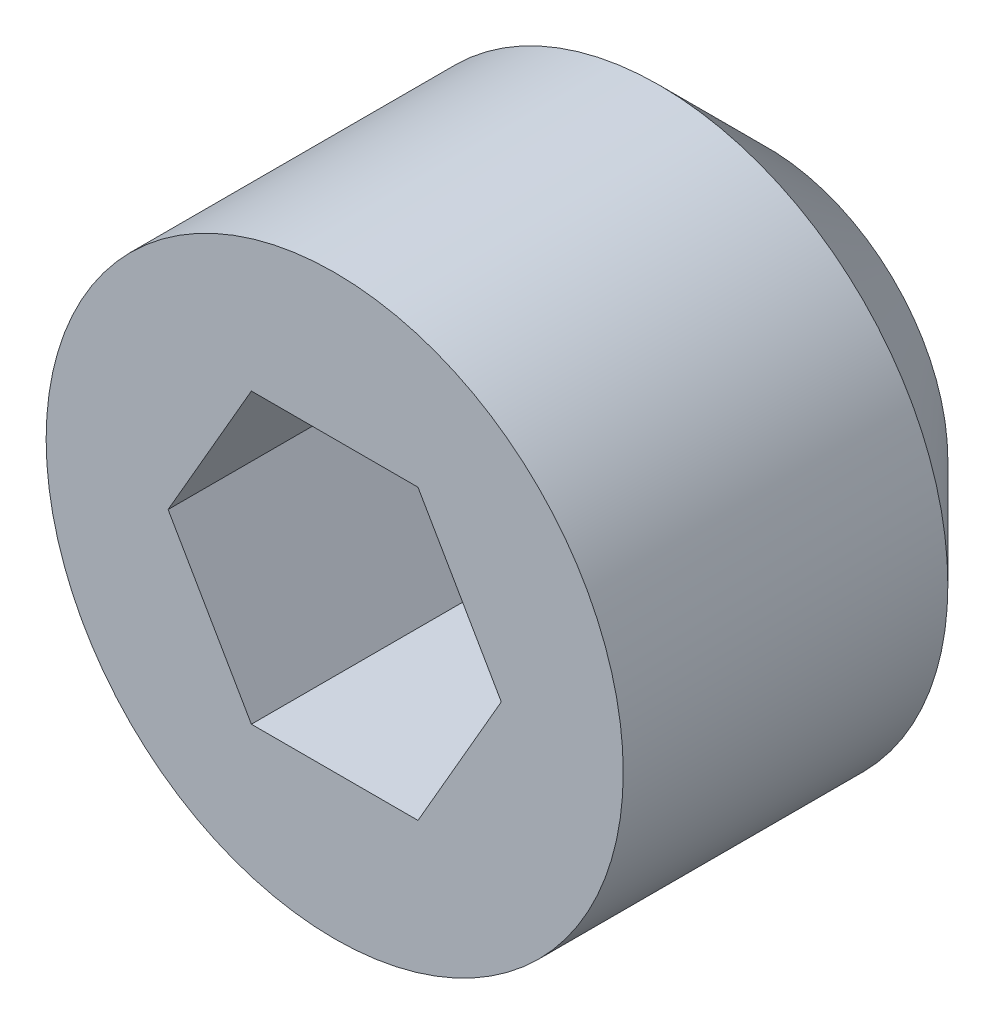
from build123d import *

# Parameters (mm, degrees)
SKETCH1_R           = 2
BOSS_EXTRUDE1_DEPTH = 3
CUT_EXTRUDE1_DEPTH  = 1.5


with BuildPart() as part:
    # Sketch1 → Boss-Extrude1 (new body)
    with BuildSketch(Plane.XY):
        Circle(SKETCH1_R)
    extrude(amount=-BOSS_EXTRUDE1_DEPTH)

    # Sketch2 → Cut-Extrude1 (cut)
    with BuildSketch(Plane.XY):
        Polygon((1.154700538, 0), (0.577350269, 1), (-0.577350269, 1), (-1.154700538, 0), (-0.577350269, -1), (0.577350269, -1), align=None)
    extrude(amount=-CUT_EXTRUDE1_DEPTH, mode=Mode.SUBTRACT)

    # Sketch3 → Chamfer 2 (revolve, cut)
    with BuildSketch(Plane(origin=(0, 0, 0), x_dir=(0, 0, -1), z_dir=(1, 0, 0)), mode=Mode.PRIVATE) as chamfer_2_sk:
        Polygon((3, 2), (3, 1.25), (2.25, 2), align=None)
    revolve(chamfer_2_sk.sketch.rotate(Axis((0, 0, 0), (0, 0, -1)), 90), axis=Axis((0, 0, 0), (0, 0, -1)), mode=Mode.SUBTRACT)


solid = part.part
